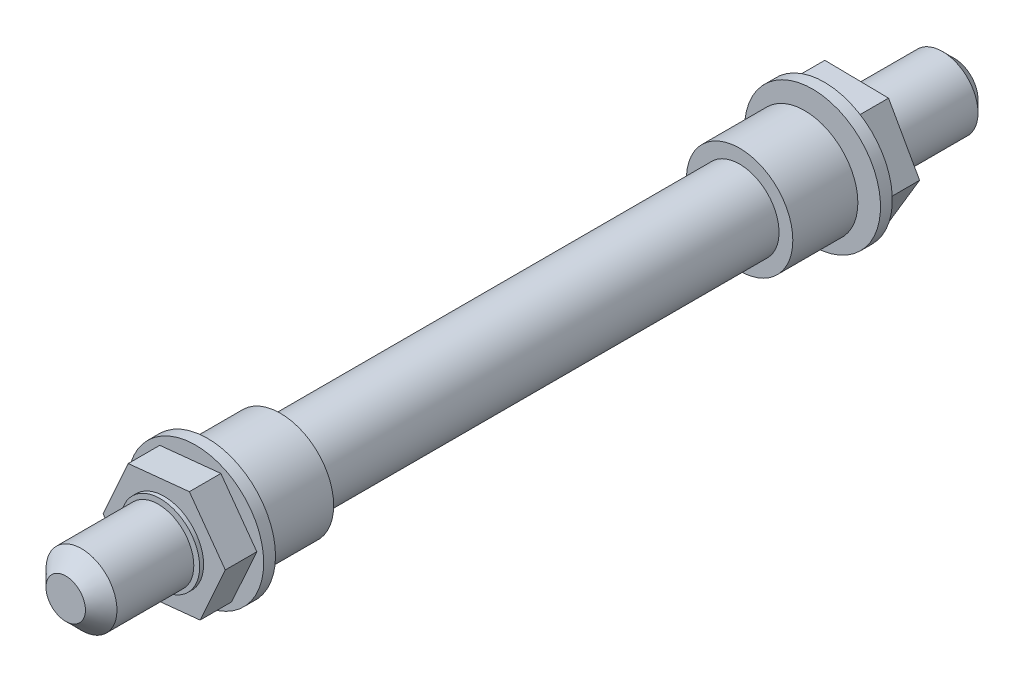
from build123d import *

# Parameters (mm, degrees)
SKETCH_1_R      = 10
EXTRUDE_1_DEPTH = 58.25
SKETCH_2_R      = 13.5
EXTRUDE_2_DEPTH = 16.5
EXTRUDE_START   = 14
SKETCH_3_R      = 10
EXTRUDE_3_DEPTH = 14
SKETCH_4_R      = 3
EXTRUDE_4_DEPTH = 0.48
SKETCH_5_R      = 9
EXTRUDE_5_DEPTH = 23.5
CHAMFER_1_SIZE  = 4
SKETCH_6_R      = 17.25
SKETCH_6_R_2    = 10.5
EXTRUDE_6_DEPTH = 3
EXTRUDE_7_DEPTH = 8
CHAMFER_2_SIZE  = 3
EXTRUDE_START_2 = 3
SKETCH_8_R      = 17.25
EXTRUDE_8_DEPTH = 3
EXTRUDE_9_DEPTH = 8


with BuildPart() as part:
    # 草图1 → 凸台-拉伸1 (new, symmetric)
    with BuildSketch(Plane.XY):
        Circle(SKETCH_1_R)
    extrude(amount=EXTRUDE_1_DEPTH, both=True)

    # 草图2 → 凸台-拉伸2 (add)
    with BuildSketch(Plane.XY.offset(58.25)):
        Circle(SKETCH_2_R)
    extrude_2 = extrude(amount=EXTRUDE_2_DEPTH)

    # 草图3 → 凸台-拉伸3 (add)
    with BuildSketch(Plane.XY.offset(74.75).offset(EXTRUDE_START)):
        Circle(SKETCH_3_R)
    extrude_3 = extrude(amount=-EXTRUDE_3_DEPTH)

    # 草图4 → 凸台-拉伸4 (add)
    with BuildSketch(Plane.XY.offset(88.75)):
        Circle(SKETCH_4_R)
    extrude_4 = extrude(amount=EXTRUDE_4_DEPTH)

    # 草图5 → 凸台-拉伸5 (add)
    with BuildSketch(Plane.XY.offset(89.23)):
        Circle(SKETCH_5_R)
    extrude_5 = extrude(amount=EXTRUDE_5_DEPTH)

    # 倒角1
    chamfer_1_edges = [part.edges().sort_by_distance(p)[0] for p in [
        (-9, 0, 112.73),
    ]]
    chamfer(chamfer_1_edges, length=CHAMFER_1_SIZE)



with BuildPart() as body_2:
    # 草图6 → 凸台-拉伸6 (new body)
    with BuildSketch(Plane.XY.offset(76.75)):
        Circle(SKETCH_6_R)
        Circle(SKETCH_6_R_2, mode=Mode.SUBTRACT)
    extrude(amount=EXTRUDE_6_DEPTH)


with BuildPart() as part_1:
    add(part.part)

    add(body_2.part)  # 凸台-拉伸7 merges body 2
    # 草图7 → 凸台-拉伸7 (add)
    with BuildSketch(Plane.XY.offset(79.75)):
        Polygon((6.392369232, 14.217510879), (-9.116540984, 12.644709585), (-15.508910216, -1.572801294), (-6.392369232, -14.217510879), (9.116540984, -12.644709585), (15.508910216, 1.572801294), align=None)
    extrude(amount=EXTRUDE_7_DEPTH)

    # 镜向3: 凸台-拉伸2, 凸台-拉伸3, 凸台-拉伸4, 凸台-拉伸5 across plane
    add(extrude_2.mirror(Plane.XY))
    add(extrude_3.mirror(Plane.XY))
    add(extrude_4.mirror(Plane.XY))
    add(extrude_5.mirror(Plane.XY))

    # 倒角2
    chamfer_2_edges = [part_1.edges().sort_by_distance(p)[0] for p in [
        (-9, 0, -112.73),
    ]]
    chamfer(chamfer_2_edges, length=CHAMFER_2_SIZE)

    # 草图8 → 凸台-拉伸8 (add)
    with BuildSketch(Plane(origin=(0, 0, -76.75), x_dir=(-1, 0, 0), z_dir=(0, 0, -1)).offset(EXTRUDE_START_2)):
        with Locations(Location((0, 0, 0), (0, 0, 180))):
            Circle(SKETCH_8_R)
    extrude(amount=-EXTRUDE_8_DEPTH)

    # 草图9 → 凸台-拉伸9 (add)
    with BuildSketch(Plane(origin=(0, 0, -79.75), x_dir=(-1, 0, 0), z_dir=(0, 0, -1))):
        Polygon((7.878667531, 14.115945993), (-8.285434063, 13.881099226), (-16.164101594, -0.234846767), (-7.878667531, -14.115945993), (8.285434063, -13.881099226), (16.164101594, 0.234846767), align=None)
    extrude(amount=EXTRUDE_9_DEPTH)


solid = part_1.part
